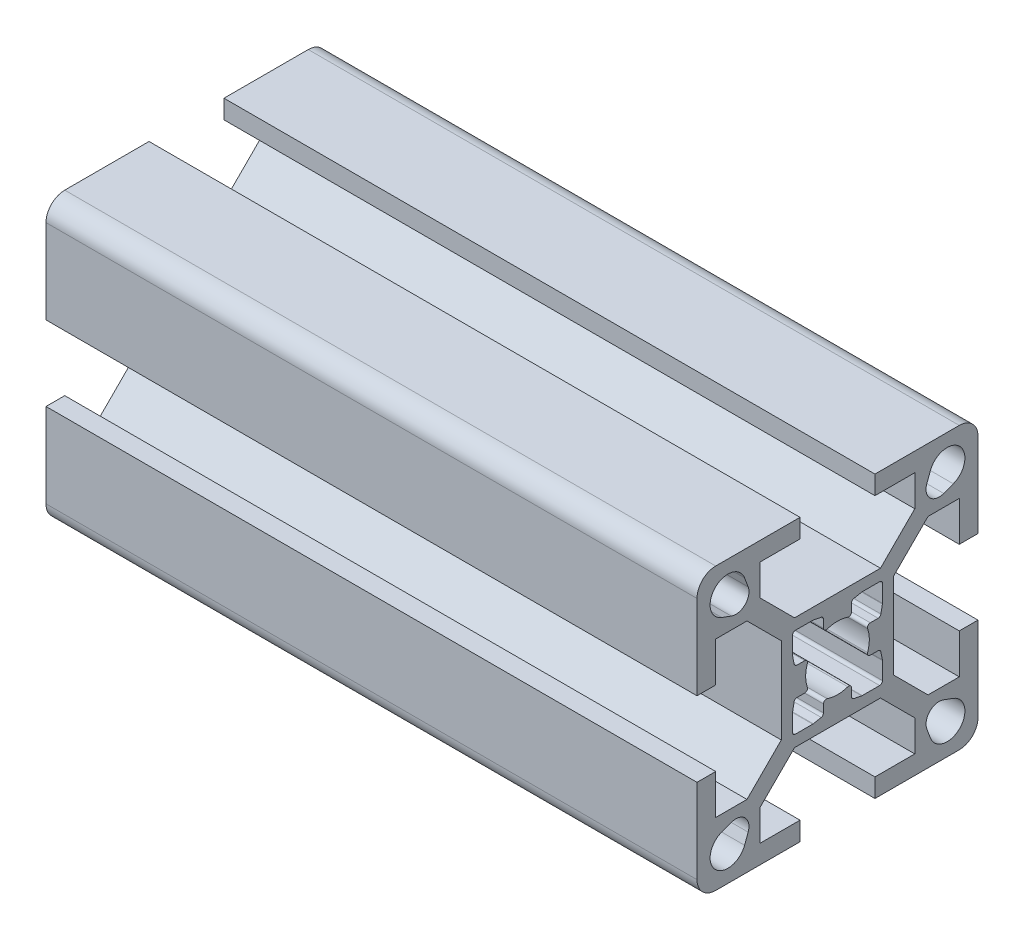
from build123d import *

# Parameters (mm, degrees)
BOSS_EXTRUDE1_DEPTH = 69.5


with BuildPart() as part:
    # Sketch1 → Boss-Extrude1 (new body)
    with BuildSketch(Plane(origin=(0, 0, 0), x_dir=(0, 0, -1), z_dir=(1, 0, 0))):
        with BuildLine():
            Line((-15, 13), (-15, 4))
            Line((-15, 4), (-13, 4))
            Line((-13, 4), (-13, 8.25))
            Line((-13, 8.25), (-9.664213562, 8.25))
            Line((-9.664213562, 8.25), (-6, 4.585786438))
            Line((-6, 4.585786438), (-6, -4.585786438))
            Line((-6, -4.585786438), (-9.664213562, -8.25))
            Line((-9.664213562, -8.25), (-13, -8.25))
            Line((-13, -8.25), (-13, -4))
            Line((-13, -4), (-15, -4))
            Line((-15, -4), (-15, -13))
            ThreePointArc((-15, -13), (-14.414213562, -14.414213562), (-13, -15))
            Line((-13, -15), (-4, -15))
            Line((-4, -15), (-4, -13))
            Line((-4, -13), (-8.25, -13))
            Line((-8.25, -13), (-8.25, -9.664213562))
            Line((-8.25, -9.664213562), (-4.585786438, -6))
            Line((-4.585786438, -6), (4.585786438, -6))
            Line((4.585786438, -6), (8.25, -9.664213562))
            Line((8.25, -9.664213562), (8.25, -13))
            Line((8.25, -13), (4, -13))
            Line((4, -13), (4, -15))
            Line((4, -15), (13, -15))
            ThreePointArc((13, -15), (14.414213562, -14.414213562), (15, -13))
            Line((15, -13), (15, -4))
            Line((15, -4), (13, -4))
            Line((13, -4), (13, -8.25))
            Line((13, -8.25), (9.664213562, -8.25))
            Line((9.664213562, -8.25), (6, -4.585786438))
            Line((6, -4.585786438), (6, 4.585786438))
            Line((6, 4.585786438), (9.664213562, 8.25))
            Line((9.664213562, 8.25), (13, 8.25))
            Line((13, 8.25), (13, 4))
            Line((13, 4), (15, 4))
            Line((15, 4), (15, 13))
            ThreePointArc((15, 13), (14.414213562, 14.414213562), (13, 15))
            Line((13, 15), (4, 15))
            Line((4, 15), (4, 13))
            Line((4, 13), (8.25, 13))
            Line((8.25, 13), (8.25, 9.664213562))
            Line((8.25, 9.664213562), (4.585786438, 6))
            Line((4.585786438, 6), (-4.585786438, 6))
            Line((-4.585786438, 6), (-8.25, 9.664213562))
            Line((-8.25, 9.664213562), (-8.25, 13))
            Line((-8.25, 13), (-4, 13))
            Line((-4, 13), (-4, 15))
            Line((-4, 15), (-13, 15))
            ThreePointArc((-13, 15), (-14.414213562, 14.414213562), (-15, 13))
        make_face()
        with BuildLine():
            Line((-9.539070071, 11.338915743), (-9.918883282, 12.361530981))
            ThreePointArc((-9.918883282, 12.361530981), (-13.043502884, 13.043502884), (-12.361530981, 9.918883282))
            Line((-12.361530981, 9.918883282), (-11.338915743, 9.539070071))
            ThreePointArc((-11.338915743, 9.539070071), (-9.861522369, 9.861522369), (-9.539070071, 11.338915743))
        make_face(mode=Mode.SUBTRACT)
        with BuildLine():
            Line((9.918883282, 12.361530981), (9.539070071, 11.338915743))
            ThreePointArc((9.539070071, 11.338915743), (9.861522369, 9.861522369), (11.338915743, 9.539070071))
            Line((11.338915743, 9.539070071), (12.361530981, 9.918883282))
            ThreePointArc((12.361530981, 9.918883282), (13.043502884, 13.043502884), (9.918883282, 12.361530981))
        make_face(mode=Mode.SUBTRACT)
        with BuildLine():
            Line((12.361530981, -9.918883282), (11.338915743, -9.539070071))
            ThreePointArc((11.338915743, -9.539070071), (9.861522369, -9.861522369), (9.539070071, -11.338915743))
            Line((9.539070071, -11.338915743), (9.918883282, -12.361530981))
            ThreePointArc((9.918883282, -12.361530981), (13.043502884, -13.043502884), (12.361530981, -9.918883282))
        make_face(mode=Mode.SUBTRACT)
        with BuildLine():
            Line((-11.338915743, -9.539070071), (-12.361530981, -9.918883282))
            ThreePointArc((-12.361530981, -9.918883282), (-13.043502884, -13.043502884), (-9.918883282, -12.361530981))
            Line((-9.918883282, -12.361530981), (-9.539070071, -11.338915743))
            ThreePointArc((-9.539070071, -11.338915743), (-9.861522369, -9.861522369), (-11.338915743, -9.539070071))
        make_face(mode=Mode.SUBTRACT)
        with BuildLine():
            Line((-4.8, -2.644433572), (-4.8, -4.5))
            ThreePointArc((-4.8, -4.5), (-4.712132034, -4.712132034), (-4.5, -4.8))
            Line((-4.5, -4.8), (-2.644433572, -4.8))
            ThreePointArc((-2.644433572, -4.8), (-2.615679847, -4.79861886), (-2.587190874, -4.794488155))
            Line((-2.587190874, -4.794488155), (-1.742757301, -4.630346896))
            ThreePointArc((-1.742757301, -4.630346896), (-1.568512625, -4.526682207), (-1.5, -4.335858741))
            Line((-1.5, -4.335858741), (-1.5, -3.5))
            ThreePointArc((-1.5, -3.5), (-1.374371458, -3.255879959), (-1.102702703, -3.216216216))
            ThreePointArc((-1.102702703, -3.216216216), (0, -3.4), (1.102702703, -3.216216216))
            ThreePointArc((1.102702703, -3.216216216), (1.374371458, -3.255879959), (1.5, -3.5))
            Line((1.5, -3.5), (1.5, -4.335858741))
            ThreePointArc((1.5, -4.335858741), (1.568512625, -4.526682207), (1.742757301, -4.630346896))
            Line((1.742757301, -4.630346896), (2.587190874, -4.794488155))
            ThreePointArc((2.587190874, -4.794488155), (2.615679847, -4.79861886), (2.644433572, -4.8))
            Line((2.644433572, -4.8), (4.5, -4.8))
            ThreePointArc((4.5, -4.8), (4.712132034, -4.712132034), (4.8, -4.5))
            Line((4.8, -4.5), (4.8, -2.644433572))
            ThreePointArc((4.8, -2.644433572), (4.79861886, -2.615679847), (4.794488155, -2.587190874))
            Line((4.794488155, -2.587190874), (4.630346896, -1.742757301))
            ThreePointArc((4.630346896, -1.742757301), (4.526682207, -1.568512625), (4.335858741, -1.5))
            Line((4.335858741, -1.5), (3.5, -1.5))
            ThreePointArc((3.5, -1.5), (3.255879959, -1.374371458), (3.216216216, -1.102702703))
            ThreePointArc((3.216216216, -1.102702703), (3.4, 0), (3.216216216, 1.102702703))
            ThreePointArc((3.216216216, 1.102702703), (3.255879959, 1.374371458), (3.5, 1.5))
            Line((3.5, 1.5), (4.335858741, 1.5))
            ThreePointArc((4.335858741, 1.5), (4.526682207, 1.568512625), (4.630346896, 1.742757301))
            Line((4.630346896, 1.742757301), (4.794488155, 2.587190874))
            ThreePointArc((4.794488155, 2.587190874), (4.79861886, 2.615679847), (4.8, 2.644433572))
            Line((4.8, 2.644433572), (4.8, 4.5))
            ThreePointArc((4.8, 4.5), (4.712132034, 4.712132034), (4.5, 4.8))
            Line((4.5, 4.8), (2.644433572, 4.8))
            ThreePointArc((2.644433572, 4.8), (2.615679847, 4.79861886), (2.587190874, 4.794488155))
            Line((2.587190874, 4.794488155), (1.742757301, 4.630346896))
            ThreePointArc((1.742757301, 4.630346896), (1.568512625, 4.526682207), (1.5, 4.335858741))
            Line((1.5, 4.335858741), (1.5, 3.5))
            ThreePointArc((1.5, 3.5), (1.374371458, 3.255879959), (1.102702703, 3.216216216))
            ThreePointArc((1.102702703, 3.216216216), (0, 3.4), (-1.102702703, 3.216216216))
            ThreePointArc((-1.102702703, 3.216216216), (-1.374371458, 3.255879959), (-1.5, 3.5))
            Line((-1.5, 3.5), (-1.5, 4.335858741))
            ThreePointArc((-1.5, 4.335858741), (-1.568512625, 4.526682207), (-1.742757301, 4.630346896))
            Line((-1.742757301, 4.630346896), (-2.587190874, 4.794488155))
            ThreePointArc((-2.587190874, 4.794488155), (-2.615679847, 4.79861886), (-2.644433572, 4.8))
            Line((-2.644433572, 4.8), (-4.5, 4.8))
            ThreePointArc((-4.5, 4.8), (-4.712132034, 4.712132034), (-4.8, 4.5))
            Line((-4.8, 4.5), (-4.8, 2.644433572))
            ThreePointArc((-4.8, 2.644433572), (-4.79861886, 2.615679847), (-4.794488155, 2.587190874))
            Line((-4.794488155, 2.587190874), (-4.630346896, 1.742757301))
            ThreePointArc((-4.630346896, 1.742757301), (-4.526682207, 1.568512625), (-4.335858741, 1.5))
            Line((-4.335858741, 1.5), (-3.5, 1.5))
            ThreePointArc((-3.5, 1.5), (-3.255879959, 1.374371458), (-3.216216216, 1.102702703))
            ThreePointArc((-3.216216216, 1.102702703), (-3.4, 0), (-3.216216216, -1.102702703))
            ThreePointArc((-3.216216216, -1.102702703), (-3.255879959, -1.374371458), (-3.5, -1.5))
            Line((-3.5, -1.5), (-4.335858741, -1.5))
            ThreePointArc((-4.335858741, -1.5), (-4.526682207, -1.568512625), (-4.630346896, -1.742757301))
            Line((-4.630346896, -1.742757301), (-4.794488155, -2.587190874))
            ThreePointArc((-4.794488155, -2.587190874), (-4.79861886, -2.615679847), (-4.8, -2.644433572))
        make_face(mode=Mode.SUBTRACT)
    extrude(amount=BOSS_EXTRUDE1_DEPTH)


solid = part.part
